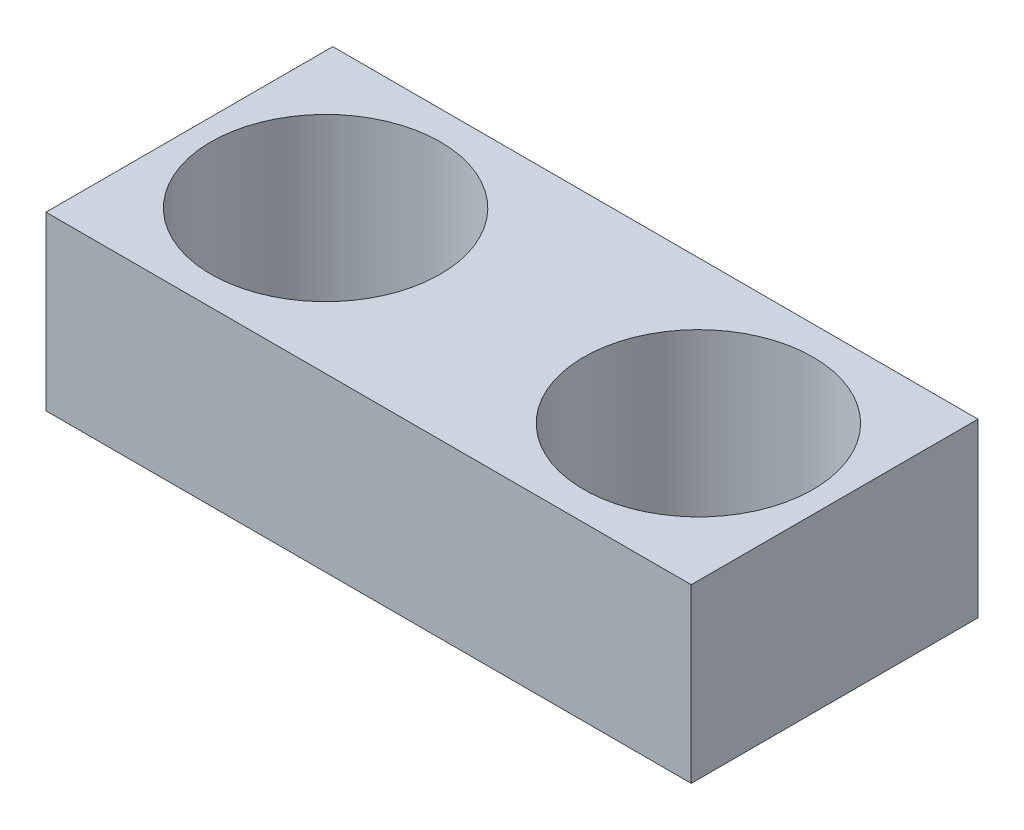
from build123d import *

# Parameters (mm, degrees)
SKETCH1_W           = 45
SKETCH1_H           = 20
BOSS_EXTRUDE2_DEPTH = 12
SKETCH3_R           = 8
CUT_EXTRUDE1_DEPTH  = 51.68530359
CUT_EXTRUDE2_DEPTH  = 4


with BuildPart() as part:
    # Sketch1 → Boss-Extrude2 (new body)
    with BuildSketch(Plane(origin=(0, 0, 0), x_dir=(1, 0, 0), z_dir=(0, 1, 0))):
        with Locations((-22.5, 10)):
            Rectangle(SKETCH1_W, SKETCH1_H)
    extrude(amount=BOSS_EXTRUDE2_DEPTH)

    # Sketch3 → Cut-Extrude1 (cut, through all)
    with BuildSketch(Plane.XZ):
        with Locations(Location((-9.5, -10, 0), (0, 0, 270))):
            Circle(SKETCH3_R)
        with Locations(Location((-35.5, -10, 0), (0, 0, 270))):
            Circle(SKETCH3_R)
    extrude(amount=-CUT_EXTRUDE1_DEPTH, mode=Mode.SUBTRACT)

    # Sketch5 → Cut-Extrude2 (cut)
    with BuildSketch(Plane.XZ):
        with BuildLine():
            Line((-18.140833695, -15.5), (-26.610870323, -15.5))
            ThreePointArc((-26.610870323, -15.5), (-28.107672495, -17.840761906), (-26.359166305, -20))
            Line((-26.359166305, -20), (-18.140833695, -20))
            ThreePointArc((-18.140833695, -20), (-16.55661493, -17.75), (-18.140833695, -15.5))
        make_face()
    extrude(amount=-CUT_EXTRUDE2_DEPTH, mode=Mode.SUBTRACT)


solid = part.part
